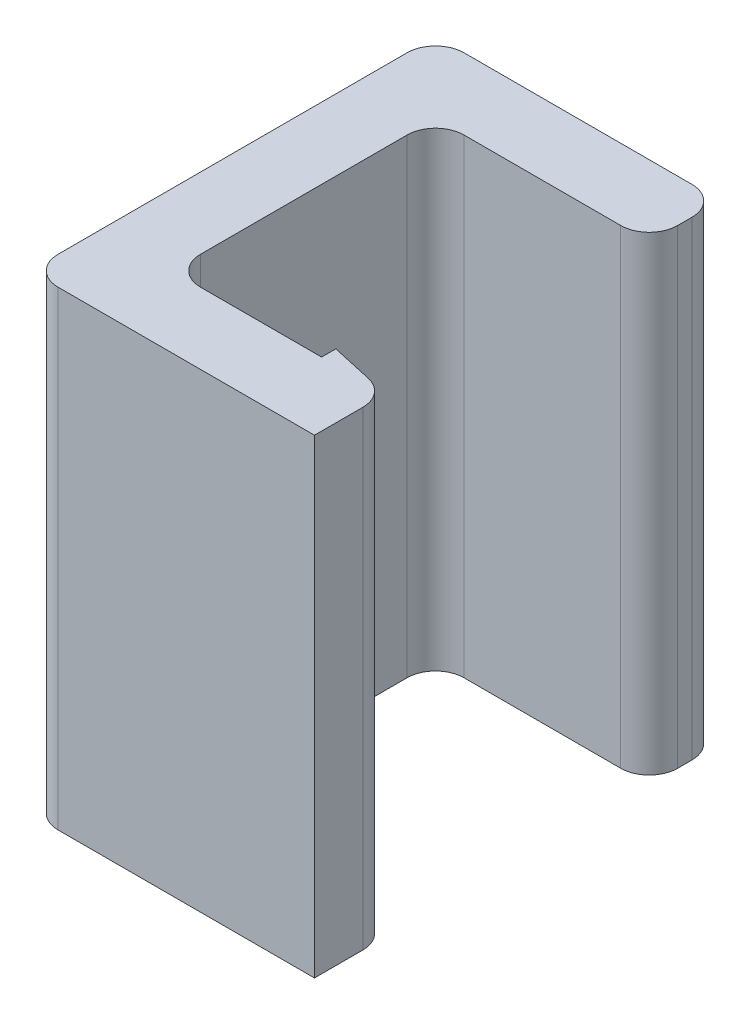
from build123d import *

# Parameters (mm, degrees)
BOSS_EXTRUDE1_DEPTH = 33
FILLET1_R           = 2


with BuildPart() as part:
    # Sketch1 → Boss-Extrude1 (new body)
    with BuildSketch(Plane(origin=(0, 0, 0), x_dir=(1, 0, 0), z_dir=(0, 1, 0))):
        Polygon((10.5, 1), (10.5, 0), (15, 0), align=None)
        Polygon((15, -5), (15, 0), (0, 0), (0, 18.5), (15, 18.5), (15, 23.5), (-5, 23.5), (-5, -5), align=None)
    extrude(amount=BOSS_EXTRUDE1_DEPTH)

    # Fillet1
    fillet1_edges = [part.edges().sort_by_distance(p)[0] for p in [
        (15, 16.5, 0),
        (-5, 16.5, 5),
        (-5, 16.5, -23.5),
        (15, 16.5, -23.5),
        (15, 16.5, -18.5),
        (0, 16.5, -18.5),
        (0, 16.5, 0),
    ]]
    fillet(fillet1_edges, radius=FILLET1_R)


solid = part.part
